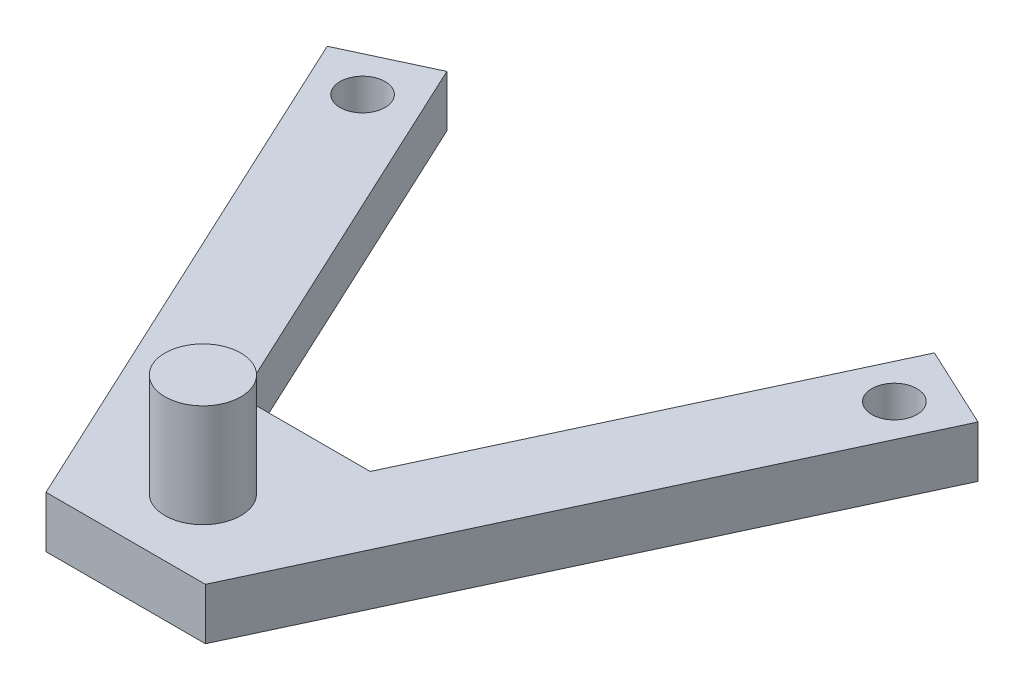
from build123d import *

# Parameters (mm, degrees)
SKETCH1_W           = 80
SKETCH1_H           = 80
BOSS_EXTRUDE1_DEPTH = 4
CUT_EXTRUDE2_REACH  = 58.71
SKETCH3_R           = 1.75
SKETCH4_W           = 80
SKETCH4_H           = 80
CUT_EXTRUDE3_DEPTH  = 4
SKETCH2_R           = 2.95
BOSS_EXTRUDE2_DEPTH = 8


with BuildPart() as part:
    # Sketch1 → Boss-Extrude1 (new body)
    with BuildSketch(Plane(origin=(0, 0, 0), x_dir=(1, 0, 0), z_dir=(0, 1, 0))):
        Rectangle(SKETCH1_W, SKETCH1_H)
    extrude(amount=BOSS_EXTRUDE1_DEPTH)

    # Sketch3 → Cut-Extrude2 (cut, up to next)
    with BuildSketch(Plane(origin=(0, 4, 0), x_dir=(1, 0, 0), z_dir=(0, 1, 0)), mode=Mode.PRIVATE) as cut_extrude2_sk1:
        with Locations(Location((20.666851305, 33.07387575, 0), (0, 0, 270))):
            Circle(SKETCH3_R)
    cut_extrude2_tool1 = extrude(cut_extrude2_sk1.sketch, amount=-CUT_EXTRUDE2_REACH, mode=Mode.PRIVATE) & part.part
    # Sketch3 → Cut-Extrude2 (cut, up to next)
    with BuildSketch(Plane(origin=(0, 4, 0), x_dir=(1, 0, 0), z_dir=(0, 1, 0)), mode=Mode.PRIVATE) as cut_extrude2_sk2:
        with Locations(Location((-20.666851305, 33.07387575, 0), (0, 0, 90))):
            Circle(SKETCH3_R)
    cut_extrude2_tool2 = extrude(cut_extrude2_sk2.sketch, amount=-CUT_EXTRUDE2_REACH, mode=Mode.PRIVATE) & part.part
    add(cut_extrude2_tool1.solids().sort_by_distance((20.666851, 4, -33.073876))[0], mode=Mode.SUBTRACT)
    add(cut_extrude2_tool2.solids().sort_by_distance((-20.666851, 4, -33.073876))[0], mode=Mode.SUBTRACT)

    # Sketch4 → Cut-Extrude3 (cut)
    with BuildSketch(Plane(origin=(0, 4, 0), x_dir=(1, 0, 0), z_dir=(0, 1, 0))):
        Rectangle(SKETCH4_W, SKETCH4_H)
        Polygon((5, 8), (18.946402637, 37.908156972), (25.290557147, 34.94982914), (6.195338219, -6), (0, -6), (-6.195338219, -6), (-25.290557147, 34.94982914), (-18.946402637, 37.908156972), (-5, 8), (0, 8), align=None, mode=Mode.SUBTRACT)
    extrude(amount=-CUT_EXTRUDE3_DEPTH, mode=Mode.SUBTRACT)

    # Sketch2 → Boss-Extrude2 (add)
    with BuildSketch(Plane(origin=(0, 4, 0), x_dir=(1, 0, 0), z_dir=(0, 1, 0))):
        with Locations(Location((0, 0, 0), (0, 0, 270))):
            Circle(SKETCH2_R)
    extrude(amount=BOSS_EXTRUDE2_DEPTH)


solid = part.part
